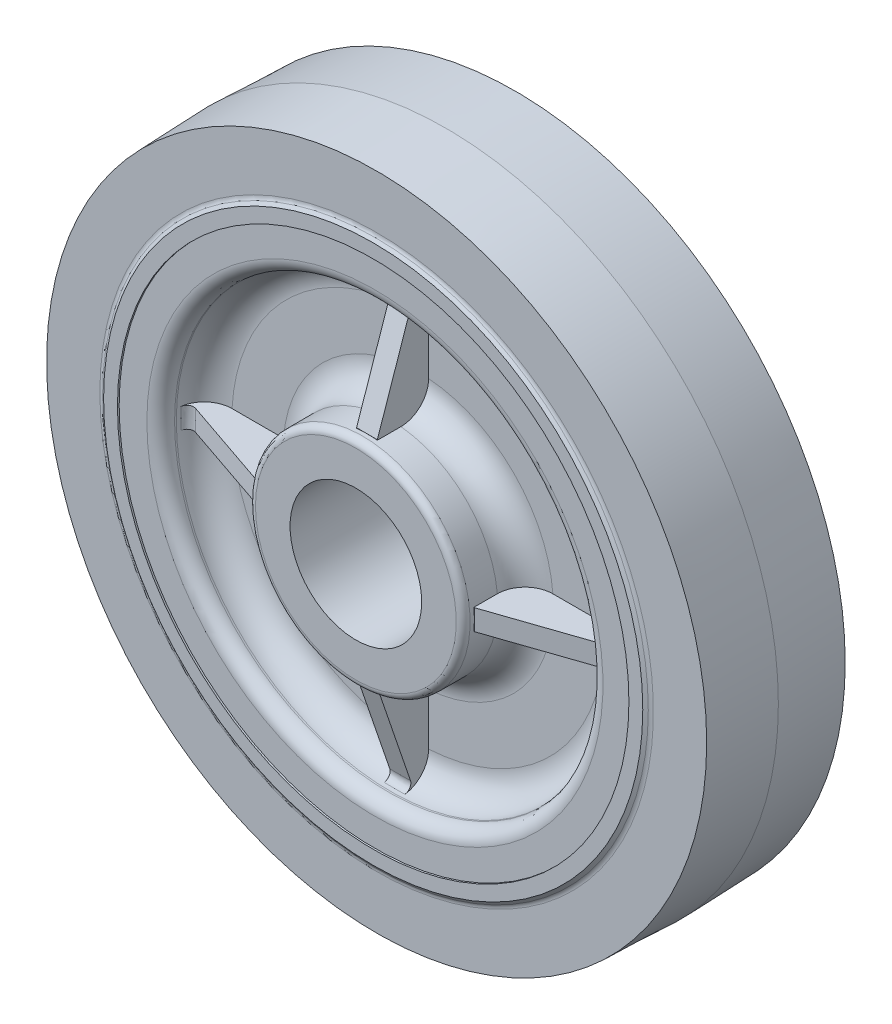
from build123d import *

# Parameters (mm, degrees)
FILLET1_R            = 6.35
FILLET2_R            = 3.175
FILLET3_R            = 1.5875
BOSS_EXTRUDE1_DEPTH  = 2.38125
CIRPATTERN1_COUNT    = 4
FILLET4_R            = 1.5875
FILLET7_R            = 6.35
FILLET8_R            = 1.5875
FILLET9_R            = 1.5875
FILLET10_R           = 3.175
MIRROR4_COPY_1_DEPTH = 2.38125
MIRROR4_COPY_2_DEPTH = 2.38125
MIRROR4_COPY_3_DEPTH = 2.38125
FILLET12_R           = 1.5875


with BuildPart() as part:
    # Sketch1 → Revolve1 (revolve)
    with BuildSketch(Plane(origin=(0, 0, 0), x_dir=(0, 0, -1), z_dir=(1, 0, 0))):
        Polygon((36.909375, 49.090903433), (26.9875, 49.090903433), (26.9875, 24.60625), (41.275, 24.60625), (41.275, 15.08125), (0, 15.08125), (0, 24.60625), (14.2875, 24.60625), (14.2875, 49.090903433), (4.365625, 49.090903433), (4.365625, 58.615903433), (3.96875, 58.615903433), (3.96875, 61.790903433), (4.7625, 62.945632784), (4.7625, 75.645632784), (20.6375, 76.2), (36.5125, 75.645632784), (36.5125, 62.945632784), (37.30625, 61.790903433), (37.30625, 58.615903433), (36.909375, 58.615903433), align=None)
    revolve(axis=Axis((0, 0, 0), (0, 0, -1)))

    # Fillet1
    fillet1_edges = [part.edges().sort_by_distance(p)[0] for p in [
        (0, -49.090903433, -14.2875),
        (0, -24.60625, -14.2875),
    ]]
    fillet(fillet1_edges, radius=FILLET1_R)

    # Fillet2
    fillet2_edges = [part.edges().sort_by_distance(p)[0] for p in [
        (0, -49.090903433, -4.365625),
    ]]
    fillet(fillet2_edges, radius=FILLET2_R)

    # Fillet3
    fillet3_edges = [part.edges().sort_by_distance(p)[0] for p in [
        (0, -62.945632784, -4.7625),
    ]]
    fillet(fillet3_edges, radius=FILLET3_R)

    # Sketch4 → Boss-Extrude1 (add, symmetric)
    with BuildSketch(Plane.ZY):
        Polygon((-20.6375, 15.08125), (-20.6375, 59.01324577), (-14.2875, 59.01324577), (-2.54, 24.60625), (-2.54, 15.08125), align=None)
    boss_extrude1 = extrude(amount=BOSS_EXTRUDE1_DEPTH, both=True)

    # CirPattern1: Boss-Extrude1 ×4 about axis
    cirpattern1_axis = Axis((0, 0, -20.6375), (0, 0, 1))
    for i in range(1, CIRPATTERN1_COUNT):
        add(boss_extrude1.rotate(cirpattern1_axis, i * 360 / CIRPATTERN1_COUNT))

    # Fillet4
    fillet4_edges = [part.edges().sort_by_distance(p)[0] for p in [
        (-48.465207278, 0, -10.686107916),
        (0, -48.465207278, -10.686107916),
        (48.465207278, 0, -10.686107916),
        (1.190921797, 48.452633057, -10.68181473),
    ]]
    fillet(fillet4_edges, radius=FILLET4_R)

    # Fillet7
    fillet7_edges = [part.edges().sort_by_distance(p)[0] for p in [
        (0, -49.090903433, -26.9875),
        (0, -24.60625, -26.9875),
    ]]
    fillet(fillet7_edges, radius=FILLET7_R)

    # Fillet8
    fillet8_edges = [part.edges().sort_by_distance(p)[0] for p in [
        (0, -24.60625, 0),
    ]]
    fillet(fillet8_edges, radius=FILLET8_R)

    # Fillet9
    fillet9_edges = [part.edges().sort_by_distance(p)[0] for p in [
        (0, -24.60625, -41.275),
    ]]
    fillet(fillet9_edges, radius=FILLET9_R)

    # Fillet10
    fillet10_edges = [part.edges().sort_by_distance(p)[0] for p in [
        (0, -49.090903433, -36.909375),
    ]]
    fillet(fillet10_edges, radius=FILLET10_R)

    # Mirror4: Boss-Extrude1 across plane
    add(boss_extrude1.mirror(Plane.XY.offset(-20.6375)))

    # Mirror4 copy 1 sketch → Mirror4 copy 1 (add, symmetric)
    with BuildSketch(Plane(origin=(0, 0, -41.275), x_dir=(0, 0, -1), z_dir=(0, -1, 0))):
        Polygon((-20.6375, -15.08125), (-20.6375, -59.01324577), (-14.2875, -59.01324577), (-2.54, -24.60625), (-2.54, -15.08125), align=None)
    extrude(amount=MIRROR4_COPY_1_DEPTH, both=True)

    # Mirror4 copy 2 sketch → Mirror4 copy 2 (add, symmetric)
    with BuildSketch(Plane(origin=(0, 0, -41.275), x_dir=(0, 0, -1), z_dir=(1, 0, 0))):
        Polygon((-20.6375, -15.08125), (-20.6375, -59.01324577), (-14.2875, -59.01324577), (-2.54, -24.60625), (-2.54, -15.08125), align=None)
    extrude(amount=MIRROR4_COPY_2_DEPTH, both=True)

    # Mirror4 copy 3 sketch → Mirror4 copy 3 (add, symmetric)
    with BuildSketch(Plane(origin=(0, 0, -41.275), x_dir=(0, 0, -1), z_dir=(0, 1, 0))):
        Polygon((-20.6375, -15.08125), (-20.6375, -59.01324577), (-14.2875, -59.01324577), (-2.54, -24.60625), (-2.54, -15.08125), align=None)
    extrude(amount=MIRROR4_COPY_3_DEPTH, both=True)

    # Fillet12
    fillet12_edges = [part.edges().sort_by_distance(p)[0] for p in [
        (-1.190921797, 48.452633058, -30.59318527),
        (-48.465207278, 0, -30.588892084),
        (0, -48.465207278, -30.588892084),
        (48.465207278, 0, -30.588892084),
    ]]
    fillet(fillet12_edges, radius=FILLET12_R)


solid = part.part
